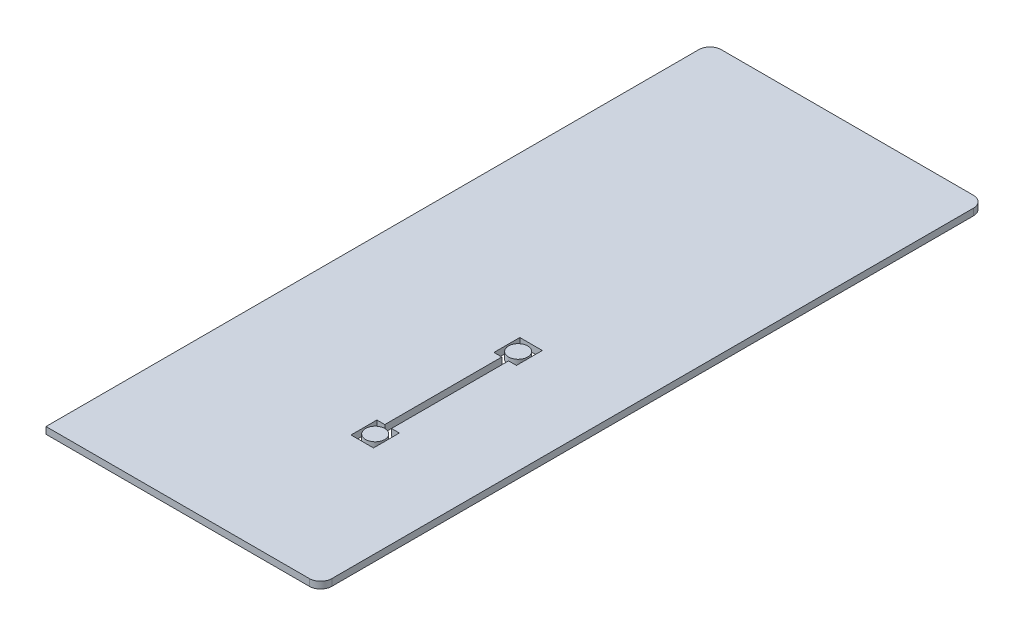
from build123d import *

# Parameters (mm, degrees)
SKETCH1_W           = 122
SKETCH1_H           = 295
BOSS_EXTRUDE1_DEPTH = 3
FILLET1_R           = 5
SKETCH2_R           = 4.25
CUT_EXTRUDE1_DEPTH  = 3


with BuildPart() as part:
    # Sketch1 → Boss-Extrude1 (new body)
    with BuildSketch(Plane(origin=(0, 0, 0), x_dir=(1, 0, 0), z_dir=(0, 1, 0))):
        with Locations((61, 147.5)):
            Rectangle(SKETCH1_W, SKETCH1_H)
    extrude(amount=BOSS_EXTRUDE1_DEPTH)

    # Fillet1
    fillet1_edges = [part.edges().sort_by_distance(p)[0] for p in [
        (0, 1.5, -295),
        (122, 1.5, -295),
        (122, 1.5, 0),
    ]]
    fillet(fillet1_edges, radius=FILLET1_R)

    # Sketch2 → Cut-Extrude1 (cut)
    with BuildSketch(Plane(origin=(0, 3, 0), x_dir=(1, 0, 0), z_dir=(0, 1, 0))):
        Polygon((71, 139.5), (81, 139.5), (81, 128), (77.5, 128), (77.5, 76), (81, 76), (81, 64.5), (71, 64.5), (71, 76), (74.5, 76), (74.5, 128), (71, 128), align=None)
        with Locations(Location((76, 133.75, 0), (0, 0, 270))):
            Circle(SKETCH2_R, mode=Mode.SUBTRACT)
        with Locations(Location((76, 70.25, 0), (0, 0, 270))):
            Circle(SKETCH2_R, mode=Mode.SUBTRACT)
    extrude(amount=-CUT_EXTRUDE1_DEPTH, mode=Mode.SUBTRACT)


with BuildPart() as cut_extrude1_piece_1:
    # of the separate pieces the step leaves, piece 1, a body of its own (cut_extrude1_pieces)
    add(part.part.solids().sort_by_distance((117, 0, 0))[0])


with BuildPart() as cut_extrude1_piece_2:
    # of the separate pieces the step leaves, piece 2, a body of its own (cut_extrude1_pieces)
    add(part.part.solids().sort_by_distance((76, 0, -66))[0])


with BuildPart() as cut_extrude1_piece_3:
    # of the separate pieces the step leaves, piece 3, a body of its own (cut_extrude1_pieces)
    add(part.part.solids().sort_by_distance((76, 0, -129.5))[0])


solid = Compound([cut_extrude1_piece_1.part, cut_extrude1_piece_2.part, cut_extrude1_piece_3.part])
